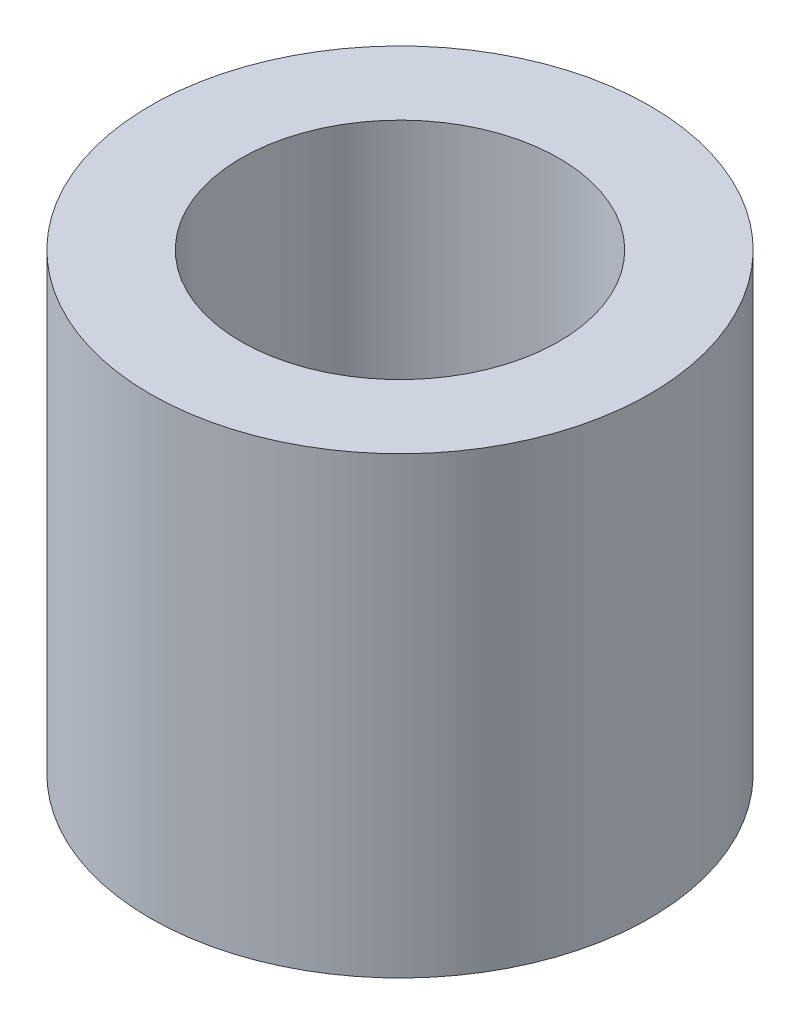
from build123d import *

# Parameters (mm, degrees)
SKETCH1_R           = 2.75
SKETCH1_R_2         = 1.75
BOSS_EXTRUDE1_DEPTH = 5


with BuildPart() as part:
    # Sketch1 → Boss-Extrude1 (new body)
    with BuildSketch(Plane(origin=(0, 0, 0), x_dir=(1, 0, 0), z_dir=(0, 1, 0))):
        with Locations(Location((0, 0, 0), (0, 0, 270))):
            Circle(SKETCH1_R)
        with Locations(Location((0, 0, 0), (0, 0, 270))):
            Circle(SKETCH1_R_2, mode=Mode.SUBTRACT)
    extrude(amount=BOSS_EXTRUDE1_DEPTH)


solid = part.part
